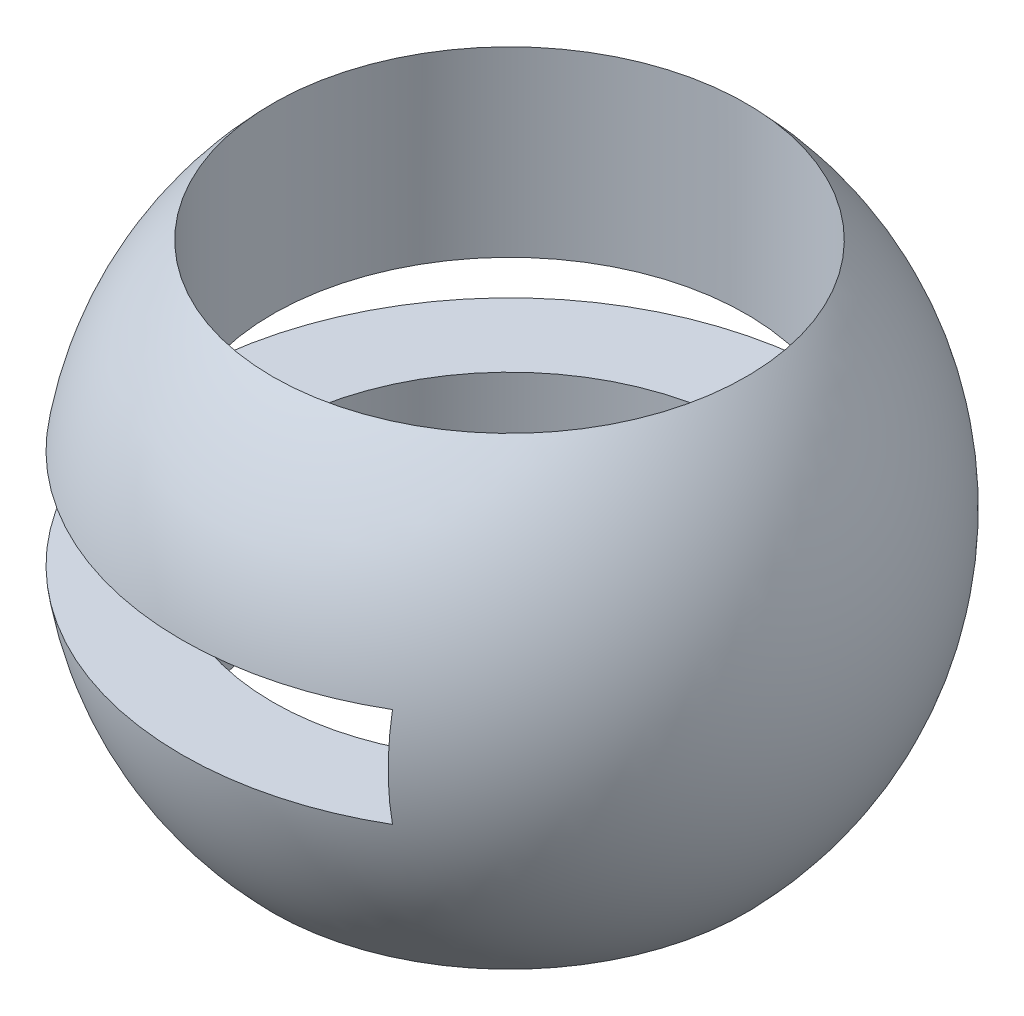
from build123d import *

# Parameters (mm, degrees)
CROQUIS3_W                 = 20
CROQUIS3_H                 = 6
CROQUIS4_W                 = 20
CROQUIS4_H                 = 6
CROQUIS8_R                 = 14.282856857
CORTAR_EXTRUIR2_DEPTH      = 40.799497484
CORTAR_EXTRUIR3_DEPTH      = 34
CORTAR_EXTRUIR3_DEPTH_BACK = 34
ESCALA1_SCALE              = 5


with BuildPart() as part:
    # Croquis1 → Revolución1 (revolve)
    with BuildSketch(Plane.XY):
        with BuildLine():
            Line((0, 20), (0, -20))
            ThreePointArc((0, -20), (20, 0), (0, 20))
        make_face()
    revolve(axis=Axis((0, 27.452088109, 0), (0, -1, 0)))

    # Croquis3 → Cortar-Revolución1 (revolve, cut)
    with BuildSketch(Plane.XY):
        with Locations((-10, 17)):
            Rectangle(CROQUIS3_W, CROQUIS3_H)
    revolve(axis=Axis((0, 20, 0), (0, -1, 0)), mode=Mode.SUBTRACT)

    # Croquis4 → Cortar-Revolución2 (revolve, cut)
    with BuildSketch(Plane.XY):
        with Locations((10, -17)):
            Rectangle(CROQUIS4_W, CROQUIS4_H)
    revolve(axis=Axis((0, 0, 0), (0, -1, 0)), mode=Mode.SUBTRACT)

    # Croquis8 → Cortar-Extruir2 (cut, through all)
    with BuildSketch(Plane(origin=(0, 14, 0), x_dir=(1, 0, 0), z_dir=(0, 1, 0))):
        Circle(CROQUIS8_R)
    extrude(amount=-CORTAR_EXTRUIR2_DEPTH, mode=Mode.SUBTRACT)

    # Croquis9 → Cortar-Extruir3 (cut, two sides: drawn at the far end of the back side and taken through both)
    with BuildSketch(Plane.XY.offset(-CORTAR_EXTRUIR3_DEPTH_BACK)):
        Polygon((-20, -3), (10, -3), (10, 0), (10, 3), (-20, 3), align=None)
    extrude(amount=CORTAR_EXTRUIR3_DEPTH + CORTAR_EXTRUIR3_DEPTH_BACK, mode=Mode.SUBTRACT)


with BuildPart() as part_1:
    # Escala1: scaled about (0, 0, 0)
    add(part.part.scale(ESCALA1_SCALE))


solid = part_1.part
